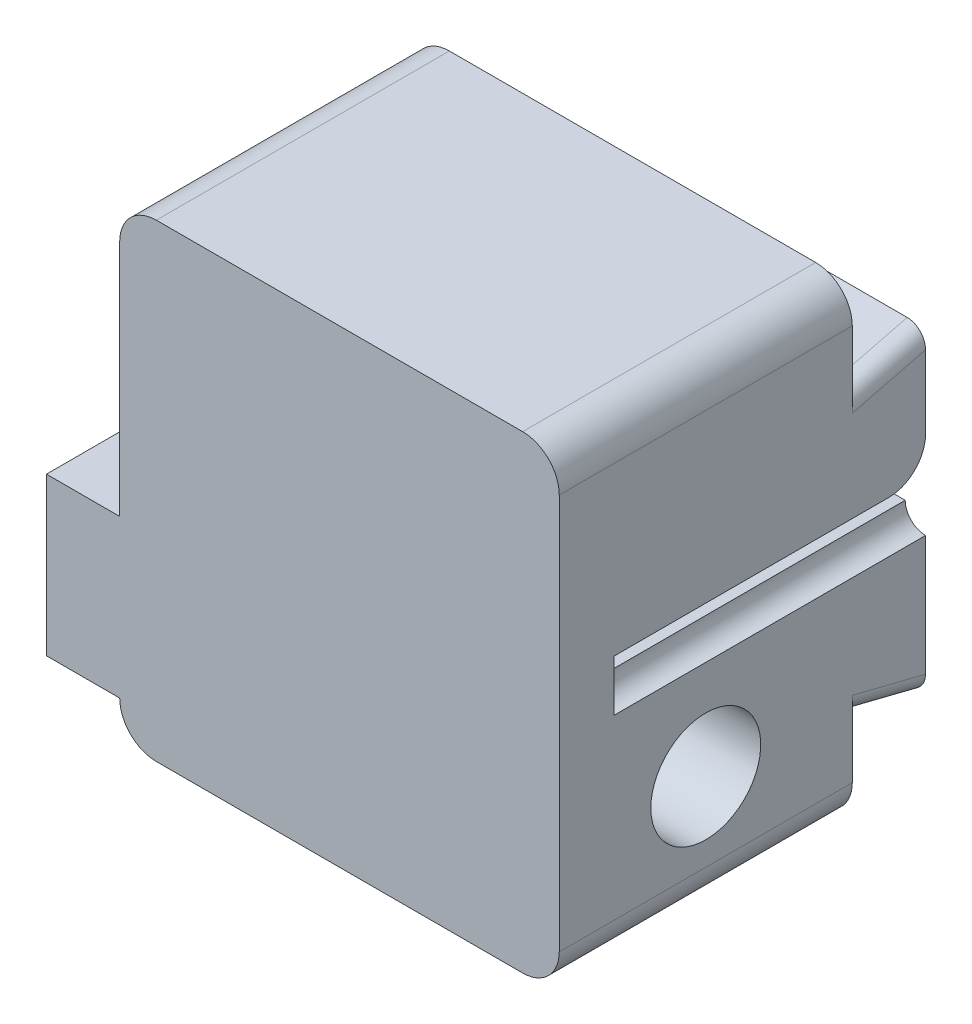
from build123d import *

# Parameters (mm, degrees)
BOSS_EXTRUDE1_DEPTH = 10
CUT_EXTRUDE1_DEPTH  = 8.5
CUT_EXTRUDE2_START  = -12
SKETCH6_R           = 1.5
CUT_EXTRUDE2_DEPTH  = 12
BOSS_EXTRUDE2_DEPTH = 2
FILLET2_R           = 0.5
FILLET3_R           = 1


with BuildPart() as part:
    # Sketch4 → Boss-Extrude1 (new body)
    with BuildSketch(Plane.XY):
        with BuildLine():
            Line((1, 0.1), (11, 0.1))
            ThreePointArc((11, 0.1), (11.707106781, 0.392893219), (12, 1.1))
            Line((12, 1.1), (12, 11.9))
            ThreePointArc((12, 11.9), (11.707106781, 12.607106781), (11, 12.9))
            Line((11, 12.9), (1, 12.9))
            ThreePointArc((1, 12.9), (0.292893219, 12.607106781), (0, 11.9))
            Line((0, 11.9), (0, 1.1))
            ThreePointArc((0, 1.1), (0.292893219, 0.392893219), (1, 0.1))
        make_face()
    extrude(amount=BOSS_EXTRUDE1_DEPTH)

    # Sketch5 → Cut-Extrude1 (cut)
    with BuildSketch(Plane.XY):
        with BuildLine():
            Line((11.445, 6.5), (10.555, 6.5))
            ThreePointArc((10.555, 6.5), (10, 5.945), (9.445, 6.5))
            Line((9.445, 6.5), (8.555, 6.5))
            ThreePointArc((8.555, 6.5), (8, 5.945), (7.445, 6.5))
            Line((7.445, 6.5), (6.555, 6.5))
            ThreePointArc((6.555, 6.5), (6, 5.945), (5.445, 6.5))
            Line((5.445, 6.5), (4.555, 6.5))
            ThreePointArc((4.555, 6.5), (4, 5.945), (3.445, 6.5))
            Line((3.445, 6.5), (2.555, 6.5))
            ThreePointArc((2.555, 6.5), (2, 5.945), (1.445, 6.5))
            Line((1.445, 6.5), (0.555, 6.5))
            ThreePointArc((0.555, 6.5), (0.392444264, 6.107555736), (0, 5.945))
            Line((0, 5.945), (0, 7.345))
            Line((0, 7.345), (12, 7.345))
            Line((12, 7.345), (12, 5.945))
            ThreePointArc((12, 5.945), (11.607555736, 6.107555736), (11.445, 6.5))
        make_face()
    extrude(amount=CUT_EXTRUDE1_DEPTH, mode=Mode.SUBTRACT)

    # Sketch6 → Cut-Extrude2 (cut)
    with BuildSketch(Plane.ZY.offset(CUT_EXTRUDE2_START)):
        with Locations((6, 3.25)):
            Circle(SKETCH6_R)
        Polygon((2, 2.65), (2, 0.1), (0, 0.1), (0, 2.15), align=None)
        Polygon((0, 12.9), (0, 10.85), (2, 10.35), (2, 12.9), align=None)
    extrude(amount=CUT_EXTRUDE2_DEPTH, mode=Mode.SUBTRACT)

    # Sketch7 → Boss-Extrude2 (add)
    with BuildSketch(Plane.ZY):
        Polygon((7.876388375, 1.1), (9.117691454, 3.25), (7.879275126, 5.395), (10, 5.395), (10, 1.1), align=None)
        Polygon((2, 1.1), (2, 5.395), (4.120724874, 5.395), (2.882308546, 3.25), (4.123611625, 1.1), align=None)
    extrude(amount=BOSS_EXTRUDE2_DEPTH)

    # Fillet2
    fillet2_edges = [part.edges().sort_by_distance(p)[0] for p in [
        (12, 2.4, 1),
        (12, 10.6, 1),
        (0, 10.6, 1),
        (0, 2.4, 1),
    ]]
    fillet(fillet2_edges, radius=FILLET2_R)

    # Fillet3
    fillet3_edges = [part.edges().sort_by_distance(p)[0] for p in [
        (6, 7.345, 0),
    ]]
    fillet(fillet3_edges, radius=FILLET3_R)


solid = part.part
